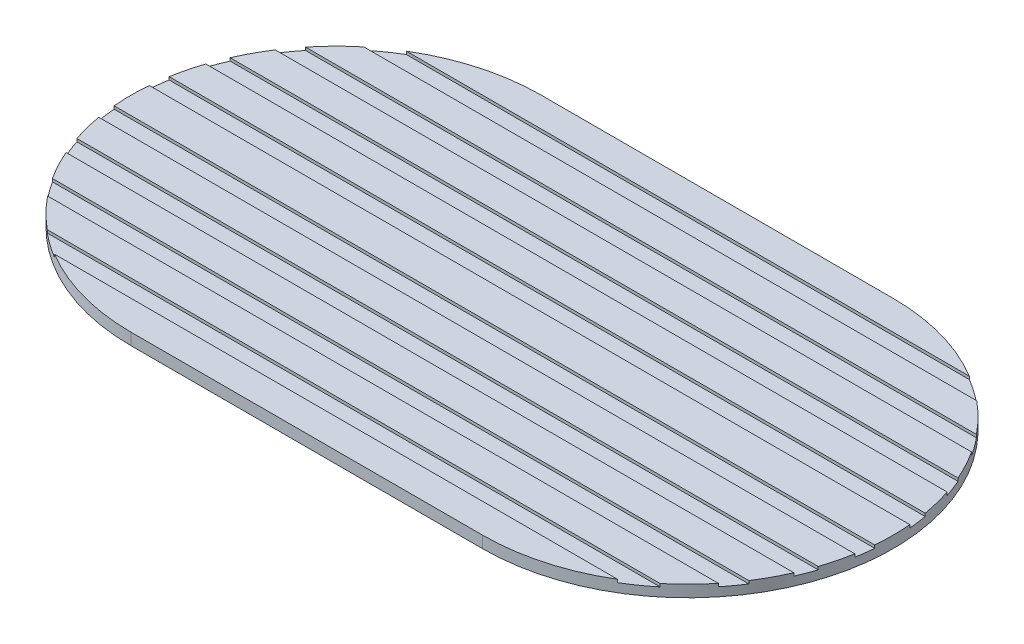
from build123d import *

# Parameters (mm, degrees)
BOSS_EXTRUDE1_DEPTH = 2
SKETCH2_W           = 110.931662833
SKETCH2_H           = 3
SKETCH2_W_2         = 124.512387616
SKETCH2_W_3         = 131.50444394
SKETCH2_W_4         = 133.924771129
CUT_EXTRUDE1_DEPTH  = 0.5


with BuildPart() as part:
    # Sketch1 → Boss-Extrude1 (new body)
    with BuildSketch(Plane(origin=(0, 0, 0), x_dir=(1, 0, 0), z_dir=(0, 1, 0))):
        with BuildLine():
            Line((0, 35), (-60, 35))
            ThreePointArc((-60, 35), (-95, 0), (-60, -35))
            Line((-60, -35), (0, -35))
            ThreePointArc((0, -35), (35, 0), (0, 35))
        make_face()
    extrude(amount=BOSS_EXTRUDE1_DEPTH)

    # Sketch2 → Cut-Extrude1 (cut)
    with BuildSketch(Plane(origin=(0, 2, 0), x_dir=(1, 0, 0), z_dir=(0, 1, 0))):
        with Locations((-30.336156555, 28.5)):
            Rectangle(SKETCH2_W, SKETCH2_H)
        with Locations((-30, 20.5)):
            Rectangle(SKETCH2_W_2, SKETCH2_H)
        with Locations((-29.865537378, 12.5)):
            Rectangle(SKETCH2_W_3, SKETCH2_H)
        with Locations((-28.655373784, 4.5)):
            Rectangle(SKETCH2_W_4, SKETCH2_H)
        with Locations((-28.655373784, -4.5)):
            Rectangle(SKETCH2_W_4, SKETCH2_H)
        with Locations((-29.865537378, -12.5)):
            Rectangle(SKETCH2_W_3, SKETCH2_H)
        with Locations((-30, -20.5)):
            Rectangle(SKETCH2_W_2, SKETCH2_H)
        with Locations((-30.336156555, -28.5)):
            Rectangle(SKETCH2_W, SKETCH2_H)
    extrude(amount=-CUT_EXTRUDE1_DEPTH, mode=Mode.SUBTRACT)


solid = part.part
